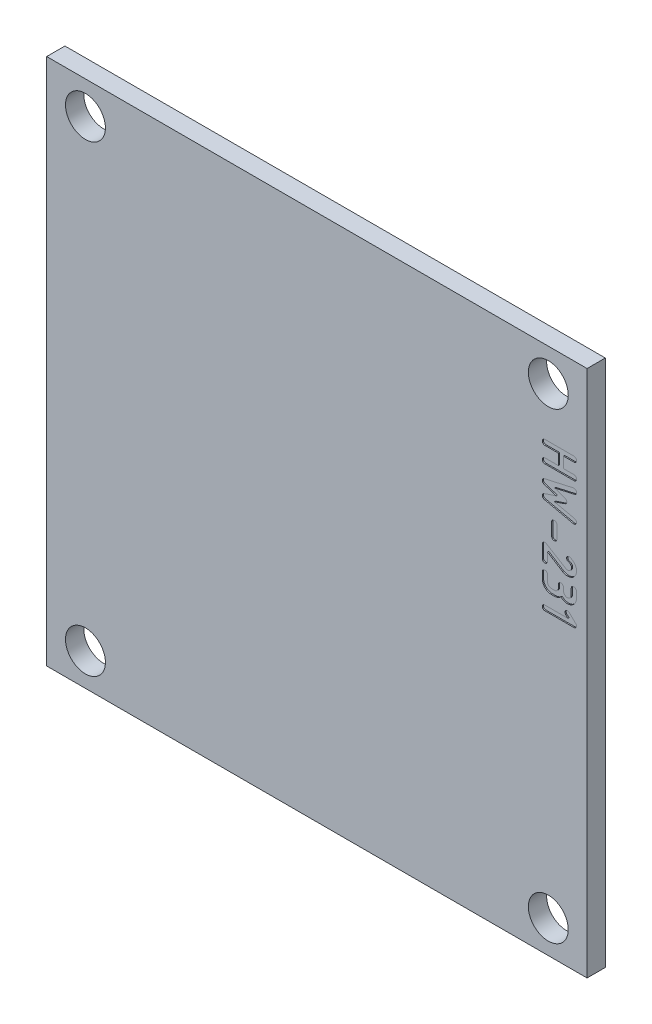
from build123d import *

# Parameters (mm, degrees)
SKETCH1_W           = 47.4
SKETCH1_H           = 46.3
BOSS_EXTRUDE1_DEPTH = 1.6
SKETCH2_R           = 1.75
CUT_EXTRUDE2_DEPTH  = 34.168848337
LABEL_DEPTH         = 0.1


with BuildPart() as part:
    # Sketch1 → Boss-Extrude1 (new body)
    with BuildSketch(Plane.XY):
        Rectangle(SKETCH1_W, SKETCH1_H)
    extrude(amount=BOSS_EXTRUDE1_DEPTH)

    # Sketch2 → Cut-Extrude2 (cut, through all)
    with BuildSketch(Plane.XY):
        with Locations((-20.3, 20.3)):
            Circle(SKETCH2_R)
        with Locations((20.3, 20.3)):
            Circle(SKETCH2_R)
        with Locations((20.3, -20.3)):
            Circle(SKETCH2_R)
        with Locations((-20.3, -20.3)):
            Circle(SKETCH2_R)
    extrude(amount=CUT_EXTRUDE2_DEPTH, mode=Mode.SUBTRACT)

    # Sketch3 → label (cut)
    with BuildSketch(Plane.XY.offset(1.6)):
        with BuildLine():
            add(Edge.make_bspline(
                [(19.997504619, 15.919305753), (19.981936231, 15.918347364), (19.951875677, 15.916496837), (19.909227086, 15.902686762), (19.87039499, 15.882855281), (19.836754065, 15.854859013), (19.808511177, 15.821672378), (19.788086144, 15.782713414), (19.77481624, 15.739452237), (19.772873404, 15.708834968), (19.771874022, 15.693085645)],
                knots=[0, 0, 0, 0, 1.050483481, 2.028348284, 3.005537133, 3.981952889, 4.967126776, 5.932165294, 6.936319424, 8, 8, 8, 8], degree=3))
            add(Edge.make_bspline(
                [(19.771874022, 15.693085645), (19.772856, 15.677327361), (19.774765002, 15.64669267), (19.788383125, 15.60320874), (19.8082471, 15.563367553), (19.836950219, 15.529549541), (19.870139048, 15.500275695), (19.909097308, 15.479749211), (19.95187936, 15.466046859), (19.981925961, 15.464176203), (19.997483778, 15.463207597)],
                knots=[0, 0, 0, 0, 1.055954639, 2.052815196, 3.03500971, 4.02352976, 5.010354396, 5.986849474, 6.957611654, 8, 8, 8, 8], degree=3))
            Line((19.997483778, 15.463207597), (21.181019768, 15.463207597))
            Line((21.181019768, 15.463207597), (21.181019768, 14.514427704))
            Line((21.181019768, 14.514427704), (19.997504619, 14.514427704))
            add(Edge.make_bspline(
                [(19.997504619, 14.514427704), (19.981918141, 14.513527376), (19.951761201, 14.511785409), (19.909215714, 14.497103052), (19.870121738, 14.476803906), (19.836954887, 14.44746067), (19.808245858, 14.413661317), (19.78838346, 14.373815152), (19.774764912, 14.330332564), (19.77285597, 14.299697685), (19.771874022, 14.283939304)],
                knots=[0, 0, 0, 0, 1.042257091, 2.016573834, 2.992510547, 3.978770912, 4.966725722, 5.948358612, 6.94464916, 8, 8, 8, 8], degree=3))
            add(Edge.make_bspline(
                [(19.771874022, 14.283939304), (19.772838241, 14.268177758), (19.774700795, 14.237731621), (19.78838065, 14.194641357), (19.808299713, 14.155447924), (19.836775027, 14.12216361), (19.870404579, 14.094220551), (19.909115267, 14.074163755), (19.951988594, 14.061338231), (19.981943202, 14.059357276), (19.997483778, 14.058329548)],
                knots=[0, 0, 0, 0, 1.064403932, 2.056079253, 3.033932639, 4.019776493, 4.99685626, 5.974709646, 6.949270913, 8, 8, 8, 8], degree=3))
            Line((19.997483778, 14.058329548), (22.545434783, 14.058330143))
            add(Edge.make_bspline(
                [(22.545434783, 14.058330143), (22.560822967, 14.059429373), (22.590993709, 14.061584569), (22.634219506, 14.07370192), (22.672855084, 14.094640025), (22.707029014, 14.121880433), (22.735251002, 14.155668619), (22.756298616, 14.194338366), (22.768799968, 14.237877396), (22.770824138, 14.268207741), (22.771874022, 14.283939304)],
                knots=[0, 0, 0, 0, 1.039548447, 2.038183825, 3.001623597, 3.987076657, 4.970618441, 5.952628526, 6.938081586, 8, 8, 8, 8], degree=3))
            add(Edge.make_bspline(
                [(22.771874022, 14.283939304), (22.770807646, 14.299668541), (22.768738444, 14.330189662), (22.756299779, 14.374115507), (22.735301404, 14.413442042), (22.706858003, 14.447744187), (22.673122632, 14.476376569), (22.634135598, 14.497581554), (22.591092231, 14.511567477), (22.560600464, 14.513461071), (22.545044754, 14.514427109)],
                knots=[0, 0, 0, 0, 1.05187569, 2.041066822, 3.025768409, 4.010469997, 5.003851649, 5.96463901, 6.961638199, 8, 8, 8, 8], degree=3))
            Line((22.545044754, 14.514427109), (21.637117329, 14.514427704))
            Line((21.637117329, 14.514427704), (21.637117329, 15.463207597))
            Line((21.637117329, 15.463207597), (22.545434783, 15.463207597))
            add(Edge.make_bspline(
                [(22.545434783, 15.463207597), (22.560838602, 15.464250559), (22.591097105, 15.466299303), (22.634248332, 15.479276592), (22.673106165, 15.500701995), (22.706862433, 15.529266337), (22.735300222, 15.563586756), (22.756300095, 15.602908413), (22.768738359, 15.646835565), (22.770807617, 15.677356502), (22.771874022, 15.693085645)],
                knots=[0, 0, 0, 0, 1.031347233, 2.025927606, 2.988234502, 3.983187238, 4.969446182, 5.955705126, 6.946460714, 8, 8, 8, 8], degree=3))
            add(Edge.make_bspline(
                [(22.771874022, 15.693085645), (22.770789747, 15.708805338), (22.768685814, 15.739307937), (22.756591726, 15.783017942), (22.735041036, 15.821449875), (22.70705071, 15.85514319), (22.672863899, 15.882434681), (22.634113184, 15.903154606), (22.590983251, 15.916283097), (22.560583816, 15.918282922), (22.545044754, 15.919305158)],
                knots=[0, 0, 0, 0, 1.060101014, 2.057027297, 3.025327702, 4.007186222, 4.990952748, 5.952743659, 6.953518549, 8, 8, 8, 8], degree=3))
            Line((22.545044754, 15.919305158), (19.997504619, 15.919305753))
        make_face()
        with BuildLine():
            add(Edge.make_bspline(
                [(22.545805162, 13.488246897), (22.537557714, 13.487778036), (22.52169255, 13.486876114), (22.506572833, 13.482008307), (22.499313046, 13.479671011)],
                knots=[0, 0, 0, 0, 1.039692879, 2, 2, 2, 2], degree=3))
            Line((22.499313046, 13.479671011), (19.948700313, 12.910832882))
            add(Edge.make_bspline(
                [(19.948700313, 12.910832882), (19.935755586, 12.907371223), (19.910762569, 12.900687628), (19.876031596, 12.883783155), (19.846169734, 12.860704434), (19.819632477, 12.833554669), (19.799394371, 12.8016937), (19.783307336, 12.767463426), (19.774397018, 12.73010654), (19.772721452, 12.704305458), (19.771874022, 12.691256377)],
                knots=[0, 0, 0, 0, 1.052452923, 2.032022383, 3.013677145, 4.008779859, 5.002082876, 5.967988144, 6.972295498, 8, 8, 8, 8], degree=3))
            add(Edge.make_bspline(
                [(19.771874022, 12.691256377), (19.772606748, 12.677972305), (19.774036509, 12.652051235), (19.784342162, 12.615059483), (19.79932936, 12.580856153), (19.821243178, 12.551095105), (19.846803146, 12.524663131), (19.876383859, 12.502735622), (19.908942124, 12.484635346), (19.932500338, 12.476483624), (19.944434998, 12.472353938)],
                knots=[0, 0, 0, 0, 1.064518943, 2.077184734, 3.062429324, 4.044429412, 5.024667577, 6.003140647, 6.988385237, 8, 8, 8, 8], degree=3))
            Line((19.944434998, 12.472353938), (20.989220511, 12.122683826))
            Line((20.989220511, 12.122683826), (19.944504667, 11.772863656))
            add(Edge.make_bspline(
                [(19.944504667, 11.772863656), (19.932540655, 11.768345367), (19.908976626, 11.759446254), (19.87671883, 11.740651165), (19.846792766, 11.719521036), (19.821269853, 11.693619546), (19.799352915, 11.664490294), (19.784223345, 11.630715059), (19.773941928, 11.593475668), (19.772581452, 11.567143766), (19.771874022, 11.553451499)],
                knots=[0, 0, 0, 0, 1.023854377, 2.016559011, 2.984875799, 3.953055383, 4.921372171, 5.891333893, 6.903519471, 8, 8, 8, 8], degree=3))
            add(Edge.make_bspline(
                [(19.771874022, 11.553451499), (19.772674204, 11.539983672), (19.774232851, 11.513750136), (19.783617431, 11.4757653), (19.798860107, 11.440903568), (19.81989233, 11.409289254), (19.846116142, 11.3821258), (19.876177815, 11.359145126), (19.910614336, 11.341766278), (19.935357736, 11.334183656), (19.948093534, 11.330280767)],
                knots=[0, 0, 0, 0, 1.053100905, 2.051300434, 3.040351302, 4.014352335, 5.003403203, 5.979087904, 6.959806266, 8, 8, 8, 8], degree=3))
            Line((19.948093534, 11.330280767), (22.499653057, 10.761335455))
            add(Edge.make_bspline(
                [(22.499653057, 10.761335455), (22.507850298, 10.759869559), (22.523069486, 10.757147943), (22.538523991, 10.757122004), (22.54565451, 10.757110036)],
                knots=[0, 0, 0, 0, 1.077224512, 2, 2, 2, 2], degree=3))
            add(Edge.make_bspline(
                [(22.54565451, 10.757110036), (22.561202761, 10.758104528), (22.591425412, 10.760037619), (22.634250243, 10.773427704), (22.673062796, 10.793922737), (22.707051838, 10.821954348), (22.735090969, 10.85619384), (22.75632112, 10.894933814), (22.768793821, 10.93849106), (22.770822038, 10.968818832), (22.771874022, 10.98454906)],
                knots=[0, 0, 0, 0, 1.045835775, 2.032892801, 2.994090291, 3.985879614, 4.977668938, 5.95739352, 6.940553065, 8, 8, 8, 8], degree=3))
            add(Edge.make_bspline(
                [(22.771874022, 10.98454906), (22.771034462, 10.99759781), (22.769387132, 11.023201207), (22.760440132, 11.06045862), (22.743706224, 11.094417482), (22.722861226, 11.126068611), (22.696397189, 11.153426635), (22.666600834, 11.176285366), (22.632590385, 11.19329089), (22.608196584, 11.200001327), (22.59565451, 11.203451499)],
                knots=[0, 0, 0, 0, 1.033552584, 2.027968669, 3.006133318, 4.013977598, 5.014742876, 6.001983677, 6.972719792, 8, 8, 8, 8], degree=3))
            Line((22.59565451, 11.203451499), (20.838177257, 11.595846221))
            Line((20.838177257, 11.595846221), (21.752828076, 11.903519382))
            add(Edge.make_bspline(
                [(21.752828076, 11.903519382), (21.764204401, 11.907635421), (21.786814262, 11.915815838), (21.818097977, 11.934019888), (21.846965687, 11.955769768), (21.871967299, 11.982201784), (21.893076087, 12.012152526), (21.908398964, 12.046036998), (21.917672779, 12.083258247), (21.919240001, 12.109089732), (21.920044754, 12.122353938)],
                knots=[0, 0, 0, 0, 0.982301123, 1.952273021, 2.931081517, 3.913374568, 4.899417108, 5.898266826, 6.92078124, 8, 8, 8, 8], degree=3))
            add(Edge.make_bspline(
                [(21.920044754, 12.122353938), (21.919261945, 12.136025382), (21.91775942, 12.162266406), (21.908513334, 12.199736633), (21.893057622, 12.233193433), (21.871939539, 12.262511108), (21.846981382, 12.288423759), (21.817745262, 12.309342359), (21.786773802, 12.328427356), (21.763919669, 12.336947534), (21.752361827, 12.341256377)],
                knots=[0, 0, 0, 0, 1.11084675, 2.132163788, 3.114834065, 4.086200084, 5.055458253, 6.023167749, 7.000272021, 8, 8, 8, 8], degree=3))
            Line((21.752361827, 12.341256377), (20.838177257, 12.64530673))
            Line((20.838177257, 12.64530673), (22.596152914, 13.041488608))
            add(Edge.make_bspline(
                [(22.596152914, 13.041488608), (22.608549383, 13.044602111), (22.632880756, 13.050713189), (22.66639616, 13.06791747), (22.696406477, 13.08997959), (22.722797605, 13.116814885), (22.744037469, 13.148067696), (22.760397698, 13.182469572), (22.769450186, 13.220484877), (22.771051788, 13.246700292), (22.771874022, 13.260158816)],
                knots=[0, 0, 0, 0, 1.007180083, 1.976859265, 2.953430731, 3.94155655, 4.935019758, 5.926663673, 6.935586262, 8, 8, 8, 8], degree=3))
            add(Edge.make_bspline(
                [(22.771874022, 13.260158816), (22.770821863, 13.27588872), (22.768793307, 13.306215869), (22.756323002, 13.349777532), (22.735083888, 13.388500978), (22.707078644, 13.422802963), (22.672888731, 13.450664531), (22.63443543, 13.472030846), (22.591400569, 13.485234173), (22.561194322, 13.487197533), (22.545805162, 13.488246897)],
                knots=[0, 0, 0, 0, 1.058586109, 2.040946813, 3.019875346, 4.010858817, 5.001842288, 5.968758973, 6.955013991, 8, 8, 8, 8], degree=3))
        make_face()
        with BuildLine():
            add(Edge.make_bspline(
                [(20.595653914, 8.851972364), (20.596361716, 8.836693915), (20.597733019, 8.807093302), (20.611718902, 8.765189638), (20.631602191, 8.726645732), (20.660137004, 8.693546896), (20.693346037, 8.664848332), (20.732586051, 8.644965164), (20.775468989, 8.631340919), (20.805707734, 8.629433027), (20.821264266, 8.628451499)],
                knots=[0, 0, 0, 0, 1.035959565, 2.007077883, 2.978491629, 3.970173763, 4.961855896, 5.945500241, 6.943048376, 8, 8, 8, 8], degree=3))
            add(Edge.make_bspline(
                [(20.821264266, 8.628451499), (20.837220277, 8.629441778), (20.868243293, 8.63136716), (20.912210471, 8.644817074), (20.95215663, 8.664870837), (20.986075781, 8.693312327), (21.01443597, 8.726842163), (21.035258343, 8.764997399), (21.04883466, 8.807042208), (21.050760881, 8.836476168), (21.051752071, 8.851622231)],
                knots=[0, 0, 0, 0, 1.074127973, 2.088409728, 3.074833382, 4.067609808, 5.049839141, 6.018505238, 6.980366772, 8, 8, 8, 8], degree=3))
            Line((21.051752071, 8.851622231), (21.051752071, 9.964653386))
            add(Edge.make_bspline(
                [(21.051752071, 9.964653386), (21.050736483, 9.979712955), (21.048758077, 10.009049597), (21.035562696, 10.050821618), (21.014160336, 10.088043873), (20.98629741, 10.121057779), (20.951705122, 10.147899347), (20.912474821, 10.168597643), (20.868003859, 10.179997537), (20.837176329, 10.182195196), (20.821264266, 10.183329548)],
                knots=[0, 0, 0, 0, 1.022766764, 1.992390428, 2.944749381, 3.924352282, 4.907840969, 5.902224966, 6.917203918, 8, 8, 8, 8], degree=3))
            add(Edge.make_bspline(
                [(20.821264266, 10.183329548), (20.805752493, 10.182205044), (20.775713758, 10.180027428), (20.732315442, 10.168449692), (20.693801673, 10.147927169), (20.659904698, 10.120822886), (20.631892625, 10.088243109), (20.611375447, 10.05062709), (20.597968159, 10.009004054), (20.596037981, 9.979572126), (20.595044754, 9.964427109)],
                knots=[0, 0, 0, 0, 1.065828302, 2.063989336, 3.055894696, 4.038242861, 5.027595556, 5.982634191, 6.961908328, 8, 8, 8, 8], degree=3))
            Line((20.595044754, 9.964427109), (20.595653914, 8.851972364))
        make_face()
        with BuildLine():
            add(Edge.make_bspline(
                [(21.569722012, 6.63928777), (21.602717131, 6.621273708), (21.667929873, 6.585670068), (21.77232712, 6.550049665), (21.878490162, 6.525771988), (21.950397577, 6.52268477), (21.986508168, 6.521134426)],
                knots=[0, 0, 0, 0, 1.028114963, 2.032003416, 3.011708027, 4, 4, 4, 4], degree=3))
            add(Edge.make_bspline(
                [(21.986508168, 6.521134426), (22.014194983, 6.522453159), (22.068399309, 6.525034932), (22.147810177, 6.53753573), (22.223578559, 6.556668967), (22.296513961, 6.581063336), (22.365043187, 6.614242391), (22.430913391, 6.652355816), (22.4923638, 6.698556231), (22.550037314, 6.750213388), (22.603050445, 6.806301662), (22.648938816, 6.867339501), (22.688696819, 6.931342668), (22.721896434, 6.998623704), (22.747669867, 7.069418169), (22.766174801, 7.143444067), (22.77975332, 7.220666789), (22.782209648, 7.273514599), (22.783459388, 7.300402719)],
                knots=[0, 0, 0, 0, 1.075942025, 2.106443502, 3.115434368, 4.109021789, 5.087154325, 6.067355234, 7.06044078, 8.066741453, 9.072050818, 10.052505995, 11.027351968, 11.994689882, 12.961157729, 13.9471902, 14.955563266, 16, 16, 16, 16], degree=3))
            add(Edge.make_bspline(
                [(22.783459388, 7.300402719), (22.782594016, 7.321771498), (22.780881498, 7.364059014), (22.772146485, 7.426474799), (22.758665292, 7.486755779), (22.741174636, 7.54503752), (22.718162998, 7.60099204), (22.690970049, 7.65522193), (22.658445139, 7.70707321), (22.609270982, 7.773122595), (22.539510829, 7.849709855), (22.444572267, 7.931593659), (22.33884706, 8.003018011), (22.261606692, 8.040542554), (22.222483778, 8.05954906)],
                knots=[0, 0, 0, 0, 0.770838101, 1.525441764, 2.268748596, 2.996757233, 3.716752486, 4.44770675, 5.181887553, 5.920699998, 7.415062594, 8.906456524, 10.433093501, 12, 12, 12, 12], degree=3))
            add(Edge.make_bspline(
                [(22.222483778, 8.05954906), (22.207171137, 8.064581763), (22.177053016, 8.074480484), (22.145373756, 8.075507576), (22.129800851, 8.076012475)],
                knots=[0, 0, 0, 0, 1.016839091, 2, 2, 2, 2], degree=3))
            add(Edge.make_bspline(
                [(22.129800851, 8.076012475), (22.114299993, 8.074867772), (22.084282393, 8.072651043), (22.041084467, 8.061442878), (22.003389779, 8.040194597), (21.969638783, 8.01372576), (21.94225451, 7.980855306), (21.922290326, 7.943267692), (21.909711979, 7.901582882), (21.907678581, 7.872239891), (21.906630119, 7.857110036)],
                knots=[0, 0, 0, 0, 1.071767579, 2.075490818, 3.048163526, 4.035985779, 5.021814846, 5.975495789, 6.956123611, 8, 8, 8, 8], degree=3))
            add(Edge.make_bspline(
                [(21.906630119, 7.857110036), (21.907144487, 7.844634342), (21.908154194, 7.820144425), (21.918219362, 7.785278197), (21.931163299, 7.75202872), (21.951235178, 7.722474522), (21.974516462, 7.695653788), (22.002168769, 7.673406502), (22.032758536, 7.654630775), (22.055441641, 7.6461739), (22.066995973, 7.641866133)],
                knots=[0, 0, 0, 0, 1.040564328, 2.042638698, 3.018259188, 4.013241442, 5.012860983, 5.979402967, 6.970747248, 8, 8, 8, 8], degree=3))
            add(Edge.make_bspline(
                [(22.066995973, 7.641866133), (22.086721441, 7.637703623), (22.12500683, 7.629624559), (22.178036055, 7.605729086), (22.224374926, 7.573200608), (22.263048702, 7.53185875), (22.292898177, 7.484224991), (22.316358113, 7.432999577), (22.329867134, 7.377301759), (22.331842633, 7.3388869), (22.332849632, 7.319305158)],
                knots=[0, 0, 0, 0, 1.057810843, 2.053117282, 3.034840609, 4.017959751, 5.008374654, 5.979800717, 6.97021562, 8, 8, 8, 8], degree=3))
            add(Edge.make_bspline(
                [(22.332849632, 7.319305158), (22.331322737, 7.296394448), (22.328350744, 7.251800373), (22.30858768, 7.188196658), (22.277780454, 7.130415668), (22.235370001, 7.080219086), (22.185422158, 7.037833187), (22.127411656, 7.007602994), (22.064071461, 6.987096108), (22.019191287, 6.984199515), (21.996264266, 6.982719792)],
                knots=[0, 0, 0, 0, 1.041237455, 2.026694996, 3.002742949, 4.000480137, 4.998217326, 5.961753585, 6.958762545, 8, 8, 8, 8], degree=3))
            add(Edge.make_bspline(
                [(21.996264266, 6.982719792), (21.980345769, 6.983211991), (21.948808656, 6.984187117), (21.902888078, 6.99485033), (21.858267924, 7.00935726), (21.831202485, 7.024907753), (21.817605729, 7.032719792)],
                knots=[0, 0, 0, 0, 1.015046019, 2.01097016, 3.000779068, 4, 4, 4, 4], degree=3))
            Line((21.817605729, 7.032719792), (20.125654033, 8.061683802))
            add(Edge.make_bspline(
                [(20.125654033, 8.061683802), (20.107087538, 8.071262309), (20.069529043, 8.090638841), (20.02734921, 8.093478831), (20.006020363, 8.094914914)],
                knots=[0, 0, 0, 0, 0.988670906, 2, 2, 2, 2], degree=3))
            add(Edge.make_bspline(
                [(20.006020363, 8.094914914), (19.990306467, 8.093789456), (19.959869586, 8.091609513), (19.915874194, 8.080043344), (19.876759985, 8.059526545), (19.842236767, 8.032441924), (19.813682705, 7.999847325), (19.79236353, 7.962379603), (19.7791035, 7.920570026), (19.777148377, 7.891150903), (19.776142315, 7.876012475)],
                knots=[0, 0, 0, 0, 1.070794826, 2.074065865, 3.070063954, 4.055149048, 5.045367603, 5.999272433, 6.970469997, 8, 8, 8, 8], degree=3))
            Line((19.776142315, 7.876012475), (19.776142315, 6.756836717))
            add(Edge.make_bspline(
                [(19.776142315, 6.756836717), (19.77715736, 6.741184074), (19.779136196, 6.710669162), (19.792348781, 6.667167632), (19.81359065, 6.627832236), (19.842210532, 6.593560664), (19.876290369, 6.564263355), (19.916090341, 6.543791021), (19.959527203, 6.529359528), (19.990248367, 6.527550811), (20.006020363, 6.526622231)],
                knots=[0, 0, 0, 0, 1.04031257, 2.028095051, 2.995697514, 3.99424057, 4.982392868, 5.961910796, 6.953661588, 8, 8, 8, 8], degree=3))
            add(Edge.make_bspline(
                [(20.006020363, 6.526622231), (20.021783081, 6.527568226), (20.052486174, 6.529410864), (20.095709192, 6.543487248), (20.134614275, 6.564529844), (20.168071659, 6.593372065), (20.195410565, 6.628074471), (20.215953945, 6.667300339), (20.2292398, 6.710550581), (20.231225076, 6.740957428), (20.232239876, 6.75650028)],
                knots=[0, 0, 0, 0, 1.054888408, 2.05474314, 3.018282329, 4.004110536, 4.993698589, 5.962810192, 6.958664187, 8, 8, 8, 8], degree=3))
            Line((20.232239876, 6.75650028), (20.232239876, 7.480055086))
            Line((20.232239876, 7.480055086), (21.569722012, 6.63928777))
        make_face()
        with BuildLine():
            add(Edge.make_bspline(
                [(21.181019768, 5.212579381), (21.179252822, 5.189475058), (21.175829384, 5.144710673), (21.156186705, 5.08087519), (21.125331023, 5.023099796), (21.082933794, 4.972901687), (21.032982409, 4.930516197), (20.974972829, 4.900285898), (20.911632384, 4.87977904), (20.866752245, 4.876882444), (20.843825241, 4.875402719)],
                knots=[0, 0, 0, 0, 1.049863455, 2.034099434, 3.00893749, 4.005437895, 5.0019383, 5.964280171, 6.96005325, 8, 8, 8, 8], degree=3))
            Line((20.843825241, 4.875402719), (20.569056282, 4.875403314))
            add(Edge.make_bspline(
                [(20.569056282, 4.875403314), (20.546038284, 4.876840527), (20.501247888, 4.879637179), (20.438015777, 4.900586766), (20.379740597, 4.9302928), (20.329796923, 4.972959795), (20.287130048, 5.022903418), (20.257423596, 5.081178677), (20.236499881, 5.144337242), (20.233684411, 5.189048199), (20.232239876, 5.211988084)],
                knots=[0, 0, 0, 0, 1.044561089, 2.032596675, 3.004154401, 4.001740602, 4.999326803, 5.970884529, 6.958920114, 8, 8, 8, 8], degree=3))
            Line((20.232239876, 5.211988084), (20.232239876, 5.768919892))
            add(Edge.make_bspline(
                [(20.232239876, 5.768919892), (20.23123692, 5.783986439), (20.229283159, 5.813336111), (20.215942707, 5.854924509), (20.195332432, 5.892288096), (20.168035356, 5.925313601), (20.134152212, 5.95195963), (20.0959141, 5.97301075), (20.052144156, 5.984239921), (20.021725071, 5.986454501), (20.006020363, 5.987597841)],
                knots=[0, 0, 0, 0, 1.032870611, 2.012034618, 2.96696585, 3.947221622, 4.929459313, 5.908921195, 6.920421765, 8, 8, 8, 8], degree=3))
            add(Edge.make_bspline(
                [(20.006020363, 5.987597841), (19.990306467, 5.986472383), (19.959869586, 5.984292439), (19.915874194, 5.97272627), (19.876759985, 5.952209472), (19.842236767, 5.925124851), (19.813682705, 5.892530252), (19.79236353, 5.85506253), (19.7791035, 5.813252953), (19.777148377, 5.78383383), (19.776142315, 5.768695402)],
                knots=[0, 0, 0, 0, 1.070794826, 2.074065865, 3.070063954, 4.055149048, 5.045367603, 5.999272433, 6.970469997, 8, 8, 8, 8], degree=3))
            Line((19.776142315, 5.768695402), (19.776142315, 5.212579381))
            add(Edge.make_bspline(
                [(19.776142315, 5.212579381), (19.777376594, 5.185085325), (19.779794436, 5.131226947), (19.793498062, 5.052628081), (19.811694235, 4.977197222), (19.838640663, 4.90566722), (19.870554514, 4.836792383), (19.910836983, 4.771987166), (19.957141, 4.710152504), (20.010147429, 4.652692616), (20.067631569, 4.599757541), (20.129217157, 4.553214827), (20.194619039, 4.51404418), (20.262765461, 4.48075155), (20.334750116, 4.455456565), (20.409446854, 4.435481924), (20.487961723, 4.423293734), (20.541549249, 4.42065054), (20.568825241, 4.419305158)],
                knots=[0, 0, 0, 0, 1.062177999, 2.080710938, 3.07674815, 4.055550719, 5.028508883, 6.004883167, 6.997416634, 8.008933398, 9.020450162, 10.012983629, 10.985276155, 11.961618862, 12.937740509, 13.928128426, 14.945419602, 16, 16, 16, 16], degree=3))
            Line((20.568825241, 4.419305158), (20.844259931, 4.419305753))
            add(Edge.make_bspline(
                [(20.844259931, 4.419305753), (20.871184455, 4.420677137), (20.924416244, 4.423388464), (21.002670519, 4.435361536), (21.077620821, 4.456032503), (21.149738493, 4.482782786), (21.219134906, 4.51642011), (21.285204777, 4.557637977), (21.348522207, 4.60583689), (21.387069341, 4.643085993), (21.406630119, 4.661988084)],
                knots=[0, 0, 0, 0, 1.029070275, 2.034548546, 3.015433787, 3.992843265, 4.96821692, 5.954613485, 6.962066746, 8, 8, 8, 8], degree=3))
            add(Edge.make_bspline(
                [(21.406630119, 4.661988084), (21.425738559, 4.643428723), (21.463822847, 4.606438783), (21.527840607, 4.559592527), (21.594718121, 4.517248554), (21.665709999, 4.482383432), (21.739581877, 4.453687254), (21.815892529, 4.434885959), (21.893579623, 4.421732497), (21.946005387, 4.420119716), (21.972483778, 4.419305158)],
                knots=[0, 0, 0, 0, 1.010667734, 2.014322509, 3.006178833, 4.014366543, 5.013766065, 6.009939782, 6.994891276, 8, 8, 8, 8], degree=3))
            add(Edge.make_bspline(
                [(21.972483778, 4.419305158), (21.999758553, 4.420660091), (22.053544356, 4.423332017), (22.13246783, 4.435475477), (22.207761331, 4.455476403), (22.28022229, 4.480612027), (22.348506172, 4.514066622), (22.413952035, 4.553179732), (22.475512654, 4.599969946), (22.533642563, 4.65244073), (22.586497348, 4.710391924), (22.633668774, 4.771741586), (22.673555623, 4.837008204), (22.70672356, 4.905340056), (22.732186671, 4.977471524), (22.751944099, 5.05243229), (22.764243828, 5.131119998), (22.76687581, 5.184710551), (22.768215485, 5.211988084)],
                knots=[0, 0, 0, 0, 1.052796664, 2.076112949, 3.072410228, 4.054262473, 5.028953779, 5.999601754, 6.990456434, 8.006057201, 9.01586307, 10.01145079, 10.986173618, 11.960864924, 12.935335544, 13.931632823, 14.947203336, 16, 16, 16, 16], degree=3))
            Line((22.768215485, 5.211988084), (22.768824646, 5.768919892))
            add(Edge.make_bspline(
                [(22.768824646, 5.768919892), (22.767555165, 5.783976409), (22.765084072, 5.813284501), (22.752033881, 5.855067057), (22.730664113, 5.892528997), (22.702124004, 5.925125191), (22.667597012, 5.95220938), (22.628483823, 5.972726295), (22.584488156, 5.984292433), (22.554051313, 5.986472381), (22.538337437, 5.987597841)],
                knots=[0, 0, 0, 0, 1.026498059, 1.998118065, 2.952437815, 3.943087085, 4.928600661, 5.925031979, 6.928739411, 8, 8, 8, 8], degree=3))
            add(Edge.make_bspline(
                [(22.538337437, 5.987597841), (22.52262151, 5.98648789), (22.492376519, 5.984351812), (22.448769025, 5.972724894), (22.410301977, 5.952164574), (22.376334629, 5.925288756), (22.349022114, 5.892294542), (22.328416302, 5.854922787), (22.315050067, 5.813264938), (22.31311412, 5.783837901), (22.312117924, 5.768695402)],
                knots=[0, 0, 0, 0, 1.079040811, 2.076592754, 3.06789284, 4.049641564, 5.029409356, 5.983865214, 6.962541785, 8, 8, 8, 8], degree=3))
            Line((22.312117924, 5.768695402), (22.31272649, 5.212579381))
            add(Edge.make_bspline(
                [(22.31272649, 5.212579381), (22.311027167, 5.189454507), (22.307730337, 5.144590278), (22.287118569, 5.080984324), (22.25646377, 5.023104752), (22.213988709, 4.972702172), (22.163422371, 4.930513236), (22.104834154, 4.900277295), (22.040886952, 4.879780897), (21.995612088, 4.876883057), (21.972483778, 4.875402719)],
                knots=[0, 0, 0, 0, 1.045159312, 2.02769817, 2.998169203, 3.990205544, 4.989326889, 5.955479558, 6.955572749, 8, 8, 8, 8], degree=3))
            add(Edge.make_bspline(
                [(21.972483778, 4.875402719), (21.949557638, 4.876883172), (21.904679189, 4.879781193), (21.841326615, 4.900277827), (21.783361742, 4.930545806), (21.73333837, 4.972702628), (21.691639402, 5.023315891), (21.660737168, 5.080852219), (21.641015875, 5.144490624), (21.638038056, 5.18907986), (21.636508168, 5.211988084)],
                knots=[0, 0, 0, 0, 1.042003833, 2.039746616, 3.003992063, 4.002463611, 4.995046956, 5.971813305, 6.957996167, 8, 8, 8, 8], degree=3))
            Line((21.636508168, 5.211988084), (21.637117329, 5.490749636))
            add(Edge.make_bspline(
                [(21.637117329, 5.490749636), (21.635851535, 5.505847556), (21.633390804, 5.535198242), (21.620324224, 5.577013933), (21.598964291, 5.614496392), (21.570387921, 5.647013567), (21.536069198, 5.674336881), (21.496493344, 5.693741965), (21.452916233, 5.706490311), (21.422371517, 5.708508813), (21.406630119, 5.70954906)],
                knots=[0, 0, 0, 0, 1.029210807, 2.000808411, 2.955106157, 3.945732585, 4.931223438, 5.921366516, 6.928764111, 8, 8, 8, 8], degree=3))
            add(Edge.make_bspline(
                [(21.406630119, 5.70954906), (21.390885842, 5.708525645), (21.360530982, 5.706552509), (21.317347692, 5.693743961), (21.27841322, 5.674290162), (21.244656151, 5.647177845), (21.217307308, 5.614261895), (21.196711012, 5.576869639), (21.183342202, 5.535217338), (21.181406616, 5.505789522), (21.180410607, 5.490646621)],
                knots=[0, 0, 0, 0, 1.079391556, 2.081059572, 3.066289647, 4.04835749, 5.028443758, 5.983209865, 6.962204556, 8, 8, 8, 8], degree=3))
            Line((21.180410607, 5.490646621), (21.181019768, 5.212579381))
        make_face()
        with BuildLine():
            add(Edge.make_bspline(
                [(22.147136027, 3.823934302), (22.135976511, 3.83320578), (22.11388052, 3.851563432), (22.075020773, 3.871310383), (22.032188983, 3.88390914), (22.002045487, 3.885940849), (21.986508168, 3.886988084)],
                knots=[0, 0, 0, 0, 0.984617066, 1.949555082, 2.943108134, 4, 4, 4, 4], degree=3))
            add(Edge.make_bspline(
                [(21.986508168, 3.886988084), (21.970962453, 3.885986822), (21.940744732, 3.884040572), (21.898057444, 3.870797678), (21.85965096, 3.850164478), (21.826565649, 3.822117274), (21.798701178, 3.788711571), (21.779157471, 3.750058332), (21.766454079, 3.707882727), (21.764393106, 3.678339954), (21.763337437, 3.663207597)],
                knots=[0, 0, 0, 0, 1.06185661, 2.064034057, 3.027712157, 4.023996381, 5.011423704, 5.980894511, 6.965776662, 8, 8, 8, 8], degree=3))
            add(Edge.make_bspline(
                [(21.763337437, 3.663207597), (21.764375438, 3.648275472), (21.766419381, 3.618872427), (21.779730822, 3.576466386), (21.801403957, 3.537453963), (21.821033034, 3.514917907), (21.831020363, 3.503451499)],
                knots=[0, 0, 0, 0, 1.008308135, 1.985472872, 2.975003028, 4, 4, 4, 4], degree=3))
            Line((21.831020363, 3.503451499), (22.020695001, 3.330814304))
            Line((22.020695001, 3.330814304), (19.997638599, 3.330814304))
            add(Edge.make_bspline(
                [(19.997638599, 3.330814304), (19.982288193, 3.330844193), (19.95250015, 3.330902194), (19.90967098, 3.320798221), (19.870746125, 3.302937789), (19.837193816, 3.276225541), (19.809278608, 3.243460518), (19.787942098, 3.205491956), (19.774862615, 3.162607673), (19.772889239, 3.132404411), (19.771874022, 3.116866133)],
                knots=[0, 0, 0, 0, 1.050116734, 2.037791315, 2.992226901, 3.965723836, 4.954873806, 5.928670294, 6.934390093, 8, 8, 8, 8], degree=3))
            add(Edge.make_bspline(
                [(19.771874022, 3.116866133), (19.772872666, 3.101723889), (19.774813372, 3.072297349), (19.78823077, 3.030370257), (19.809236256, 2.992687961), (19.837347794, 2.959909165), (19.871066244, 2.932585953), (19.910038771, 2.913165335), (19.953016269, 2.90041063), (19.98316386, 2.898393604), (19.99870329, 2.897353938)],
                knots=[0, 0, 0, 0, 1.03597359, 2.013249652, 2.985258413, 3.972592471, 4.95293629, 5.936436789, 6.936346373, 8, 8, 8, 8], degree=3))
            Line((19.99870329, 2.897353938), (22.545805162, 2.897353938))
            add(Edge.make_bspline(
                [(22.545805162, 2.897353938), (22.561286681, 2.898410051), (22.591368865, 2.900462186), (22.634221553, 2.912979816), (22.67283153, 2.932969936), (22.707011663, 2.959659211), (22.735042731, 2.992737343), (22.75630565, 3.03024751), (22.768738206, 3.072420366), (22.770807204, 3.10174549), (22.771874022, 3.116866133)],
                knots=[0, 0, 0, 0, 1.061424435, 2.062456983, 3.034659081, 4.027022831, 5.015465728, 5.988566119, 6.962862944, 8, 8, 8, 8], degree=3))
            add(Edge.make_bspline(
                [(22.771874022, 3.116866133), (22.770882276, 3.132419588), (22.768954521, 3.162652353), (22.755443367, 3.205669763), (22.734831126, 3.245082978), (22.714880818, 3.266845931), (22.704800851, 3.277841743)],
                knots=[0, 0, 0, 0, 1.042409051, 2.026231944, 3.002746418, 4, 4, 4, 4], degree=3))
            Line((22.704800851, 3.277841743), (22.147136027, 3.823934302))
        make_face()
    extrude(amount=-LABEL_DEPTH, mode=Mode.SUBTRACT)


solid = part.part
